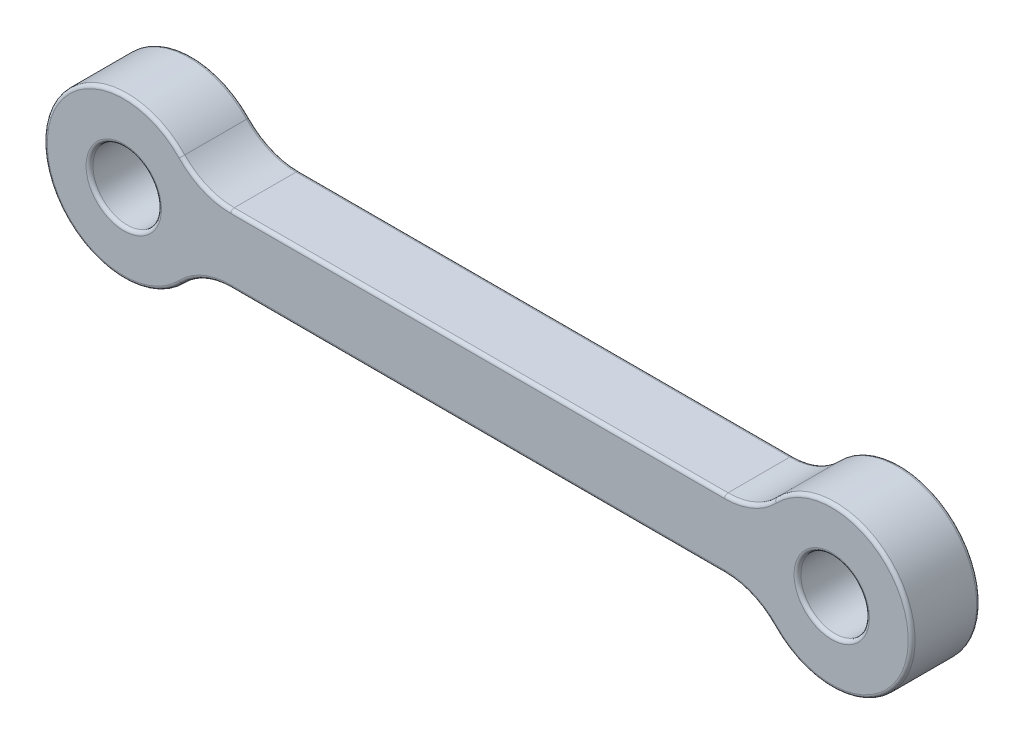
from build123d import *

# Parameters (mm, degrees)
SKETCH1_R           = 3.5
SKETCH1_R_2         = 1.5
BOSS_EXTRUDE1_DEPTH = 3
FILLET1_R           = 3
FILLET2_R           = 0.15


with BuildPart() as part:
    # Sketch1 → Boss-Extrude1 (new body)
    # profile 1 of 3: a face of its own
    with BuildSketch(Plane.XY):
        Circle(SKETCH1_R)
        Circle(SKETCH1_R_2, mode=Mode.SUBTRACT)
    # profile 2 of 3: a face of its own
    with BuildSketch(Plane.XY):
        with BuildLine():
            ThreePointArc((27.83772234, -1.5), (27.5, 0), (27.83772234, 1.5))
            Line((27.83772234, 1.5), (3.16227766, 1.5))
            ThreePointArc((3.16227766, 1.5), (3.414525722, 0.768774411), (3.5, 0))
            ThreePointArc((3.5, 0), (3.414525722, -0.768774411), (3.16227766, -1.5))
            Line((3.16227766, -1.5), (27.83772234, -1.5))
        make_face()
    # profile 3 of 3: a face of its own
    with BuildSketch(Plane.XY):
        with Locations((31, 0)):
            Circle(SKETCH1_R)
        with Locations((31, 0)):
            Circle(SKETCH1_R_2, mode=Mode.SUBTRACT)
    extrude(amount=BOSS_EXTRUDE1_DEPTH)

    # Fillet1
    fillet1_edges = [part.edges().sort_by_distance(p)[0] for p in [
        (3.16227766, 1.5, 1.5),
        (27.83772234, 1.5, 1.5),
        (27.83772234, -1.5, 1.5),
        (3.16227766, -1.5, 1.5),
    ]]
    fillet(fillet1_edges, radius=FILLET1_R)

    # Fillet2
    fillet2_edges = [part.edges().sort_by_distance(p)[0] for p in [
        (-1.5, 0, 0),
        (15.5, -1.5, 0),
        (15.5, -1.5, 3),
        (-3.5, 0, 0),
        (-3.5, 0, 3),
        (34.5, 0, 0),
        (34.5, 0, 3),
        (15.5, 1.5, 0),
        (15.5, 1.5, 3),
        (3.513718949, -1.740401367, 0),
        (3.513718949, -1.740401367, 3),
        (27.486281051, -1.740401367, 0),
        (29.5, 0, 3),
        (27.486281051, -1.740401367, 3),
        (27.486281051, 1.740401367, 0),
        (27.486281051, 1.740401367, 3),
        (3.513718949, 1.740401367, 0),
        (3.513718949, 1.740401367, 3),
        (-1.5, 0, 3),
        (29.5, 0, 0),
    ]]
    fillet(fillet2_edges, radius=FILLET2_R)


solid = part.part
